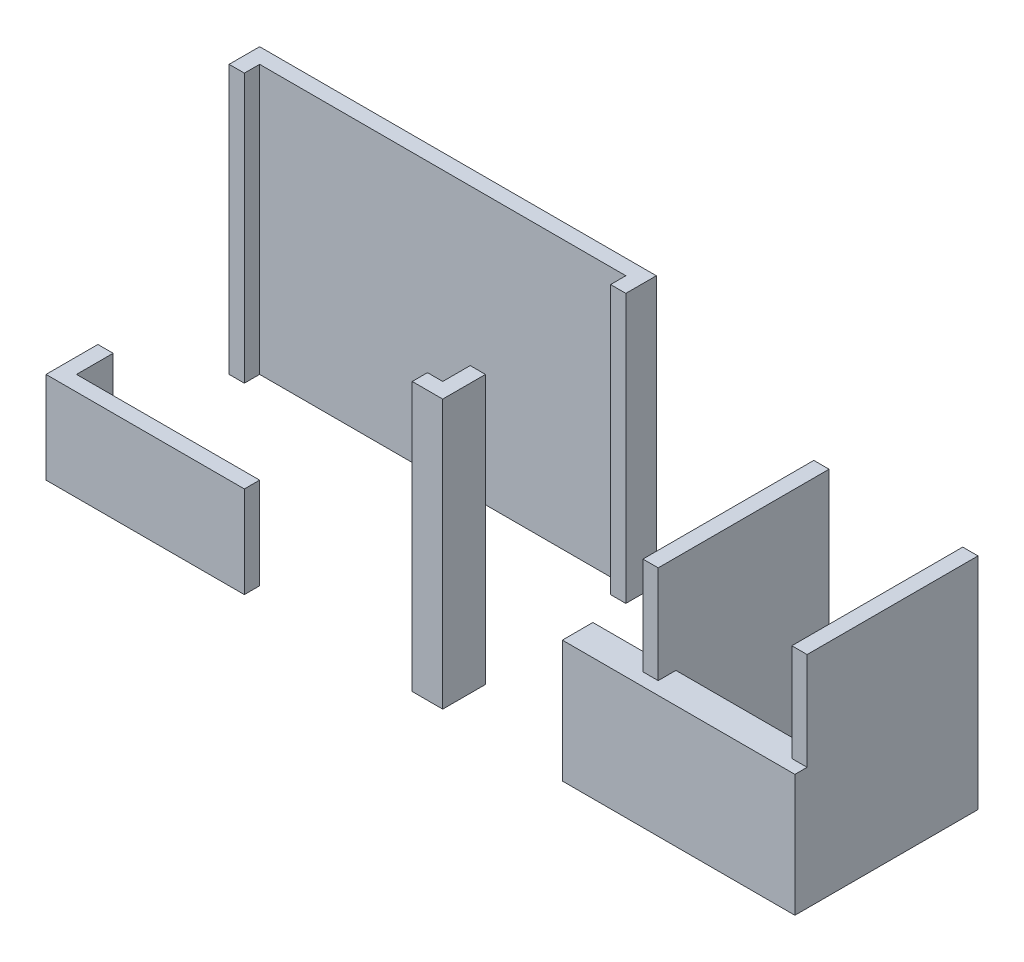
from build123d import *

# Parameters (mm, degrees)
BOSS_EXTRUDE2_DEPTH      = 44
BOSS_EXTRUDE2_2_DEPTH    = 44
BOSS_EXTRUDE3_DEPTH      = 15
SKETCH17_W               = 5
SKETCH17_H               = 20
BOSS_EXTRUDE4_DEPTH      = 38.1
BOSS_EXTRUDE5_DEPTH      = 25
BOSS_EXTRUDE5_DEPTH_BACK = 3
BOSS_EXTRUDE6_DEPTH      = 25.1
BOSS_EXTRUDE6_DEPTH_BACK = 2.9


with BuildPart() as part:
    # Sketch11 → Boss-Extrude2 (new body)
    with BuildSketch(Plane(origin=(0, 0, 0), x_dir=(1, 0, 0), z_dir=(0, 1, 0))):
        Polygon((-38.899641352, 12.364528858), (-38.899641352, 7.364528858), (-36.399641352, 7.364528858), (-36.399641352, 9.864528858), (23.600358648, 9.864528858), (23.600358648, 7.364528858), (26.100358648, 7.364528858), (26.100358648, 12.364528858), align=None)
    extrude(amount=BOSS_EXTRUDE2_DEPTH)


with BuildPart() as body_2:
    # Sketch11 → Boss-Extrude2 2 (new body)
    with BuildSketch(Plane(origin=(0, 0, 0), x_dir=(1, 0, 0), z_dir=(0, 1, 0))):
        Polygon((26.100358648, -22.635471142), (26.100358648, -15.635471142), (23.600358648, -15.635471142), (23.600358648, -20.135471142), (21.100358648, -20.135471142), (21.100358648, -22.635471142), align=None)
    extrude(amount=BOSS_EXTRUDE2_2_DEPTH)


with BuildPart() as body_3:
    # Sketch13 → Boss-Extrude3 (new body)
    with BuildSketch(Plane(origin=(0, 0, 0), x_dir=(1, 0, 0), z_dir=(0, 1, 0))):
        Polygon((-38.899641352, -14.135471142), (-36.399641352, -14.135471142), (-36.399641352, -20.135471142), (-6.399641352, -20.135471142), (-6.399641352, -22.635471142), (-38.899641352, -22.635471142), align=None)
    extrude(amount=BOSS_EXTRUDE3_DEPTH)


with BuildPart() as body_4:
    # Sketch17 → Boss-Extrude4 (new body)
    with BuildSketch(Plane(origin=(26.100358648, 0, 0), x_dir=(0, 0, -1), z_dir=(1, 0, 0))):
        with Locations((-0.535471142, -10)):
            Rectangle(SKETCH17_W, SKETCH17_H)
    extrude(amount=BOSS_EXTRUDE4_DEPTH)

    # Sketch19 → Boss-Extrude5 (add, two sides: drawn at the far end of the back side and taken through both)
    with BuildSketch(Plane(origin=(0, 0, -1.964528858), x_dir=(-1, 0, 0), z_dir=(0, 0, -1)).offset(-BOSS_EXTRUDE5_DEPTH_BACK)):
        Polygon((-64.200358648, 0), (-64.200358648, 16), (-61.700358648, 16), (-61.700358648, -20), (-64.200358648, -20), align=None)
    extrude(amount=BOSS_EXTRUDE5_DEPTH + BOSS_EXTRUDE5_DEPTH_BACK)

    # Sketch24 → Boss-Extrude6 (add, two sides: drawn at the far end of the back side and taken through both)
    with BuildSketch(Plane(origin=(0, 0, -1.964528858), x_dir=(-1, 0, 0), z_dir=(0, 0, -1)).offset(-BOSS_EXTRUDE6_DEPTH_BACK)):
        Polygon((-39.700358648, 0), (-39.700358648, 16), (-37.200358648, 16), (-37.200358648, -20), (-39.700358648, -20), align=None)
    extrude(amount=BOSS_EXTRUDE6_DEPTH + BOSS_EXTRUDE6_DEPTH_BACK)


solid = Compound([part.part, body_2.part, body_3.part, body_4.part])
